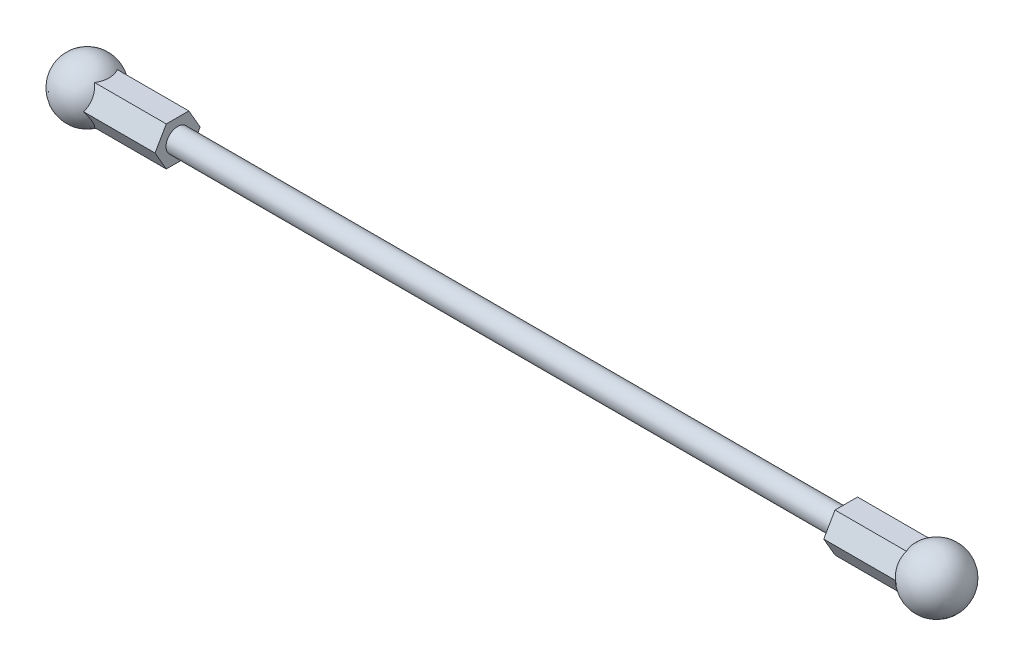
from build123d import *

# Parameters (mm, degrees)
BOSS_EXTRUDE2_DEPTH = 9.25
SKETCH5_R           = 1.190625
BOSS_EXTRUDE3_DEPTH = 68.5


with BuildPart() as part:
    # Sketch2 → Revolve1 (revolve)
    with BuildSketch(Plane.XY):
        with BuildLine():
            Line((0, 3), (0, -3))
            ThreePointArc((0, -3), (3, 0), (0, 3))
        make_face()
    revolve(axis=Axis((0, 3, 0), (0, -1, 0)))

    # Sketch3 → Boss-Extrude2 (add)
    with BuildSketch(Plane(origin=(0, 0, 0), x_dir=(0, 0, -1), z_dir=(1, 0, 0))):
        Polygon((1.154700538, -2), (2.309401077, 0), (1.154700538, 2), (-1.154700538, 2), (-2.309401077, 0), (-1.154700538, -2), align=None)
    boss_extrude2 = extrude(amount=BOSS_EXTRUDE2_DEPTH)

    # Sketch5 → Boss-Extrude3 (add)
    with BuildSketch(Plane(origin=(9.25, 0, 0), x_dir=(0, 0, -1), z_dir=(1, 0, 0))):
        with Locations(Location((0.007936131, 0, 0), (0, 0, 180))):
            Circle(SKETCH5_R)
    extrude(amount=BOSS_EXTRUDE3_DEPTH)


with BuildPart() as body_2:
    # Sketch7 → Revolve2 (revolve)
    with BuildSketch(Plane(origin=(87, 0, 0), x_dir=(0, 0, -1), z_dir=(1, 0, 0))):
        with BuildLine():
            ThreePointArc((0, 3), (3, 0), (0, -3))
            Line((0, -3), (0, 3))
        make_face()
    revolve(axis=Axis((87, 3, 0), (0, -1, 0)))

    # Mirror3: Boss-Extrude2 across plane
    add(boss_extrude2.mirror(Plane(origin=(43.5, 0, 0), x_dir=(0, 0, 1), z_dir=(1, 0, 0))))


solid = Compound([part.part, body_2.part])
